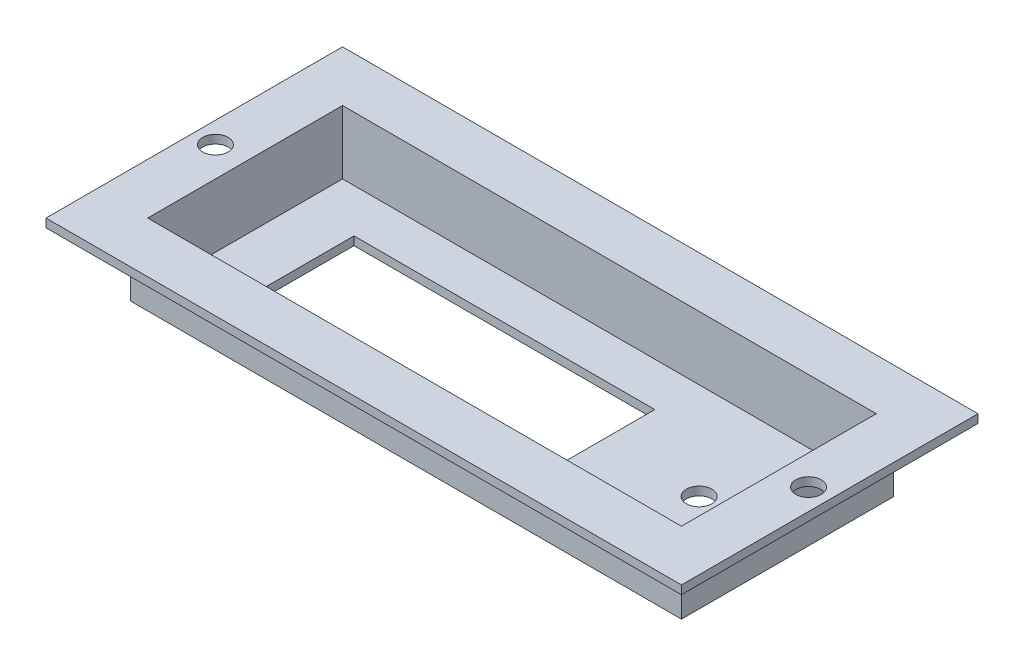
from build123d import *

# Parameters (mm, degrees)
CROQUIS1_W              = 130
CROQUIS1_H              = 50
SALIENTE_EXTRUIR1_DEPTH = 30
CROQUIS2_W              = 126
CROQUIS2_H              = 46
CORTAR_EXTRUIR1_DEPTH   = 28
CROQUIS3_R              = 3
CROQUIS3_W              = 70.999999967
CROQUIS3_H              = 24.5
CORTAR_EXTRUIR2_DEPTH   = 2
CROQUIS9_W              = 150
CROQUIS9_H              = 70
CROQUIS9_W_2            = 130
CROQUIS9_H_2            = 50
SALIENTE_EXTRUIR3_DEPTH = 15
CROQUIS9_2_W            = 150
CROQUIS9_2_H            = 70
CROQUIS9_2_W_2          = 130
CROQUIS9_2_H_2          = 50
CORTAR_EXTRUIR5_DEPTH   = 13
CROQUIS11_R             = 3
CORTAR_EXTRUIR6_DEPTH   = 2
CROQUIS12_W             = 50
CROQUIS12_H             = 13
CORTAR_EXTRUIR7_DEPTH   = 130


with BuildPart() as part:
    # Croquis1 → Saliente-Extruir1 (new body)
    with BuildSketch(Plane(origin=(0, 0, 0), x_dir=(1, 0, 0), z_dir=(0, 1, 0))):
        Rectangle(CROQUIS1_W, CROQUIS1_H)
    extrude(amount=SALIENTE_EXTRUIR1_DEPTH)

    # Croquis2 → Cortar-Extruir1 (cut)
    with BuildSketch(Plane(origin=(0, 30, 0), x_dir=(1, 0, 0), z_dir=(0, 1, 0))):
        Rectangle(CROQUIS2_W, CROQUIS2_H)
    extrude(amount=-CORTAR_EXTRUIR1_DEPTH, mode=Mode.SUBTRACT)

    # Croquis3 → Cortar-Extruir2 (cut)
    with BuildSketch(Plane.XZ):
        with Locations(Location((43.9980881, -0.173527089, 0), (0, 0, 270))):
            Circle(CROQUIS3_R)
        with Locations((-14.500000016, -0.45006101)):
            Rectangle(CROQUIS3_W, CROQUIS3_H)
    extrude(amount=-CORTAR_EXTRUIR2_DEPTH, mode=Mode.SUBTRACT)

    # Croquis9 → Saliente-Extruir3 (add)
    with BuildSketch(Plane(origin=(0, 30, 0), x_dir=(1, 0, 0), z_dir=(0, 1, 0))):
        Rectangle(CROQUIS9_W, CROQUIS9_H)
        Rectangle(CROQUIS9_W_2, CROQUIS9_H_2, mode=Mode.SUBTRACT)
    extrude(amount=-SALIENTE_EXTRUIR3_DEPTH)

    # Croquis9<2> → Cortar-Extruir5 (cut)
    with BuildSketch(Plane(origin=(0, 30, 0), x_dir=(1, 0, 0), z_dir=(0, 1, 0))):
        Rectangle(CROQUIS9_2_W, CROQUIS9_2_H)
        Rectangle(CROQUIS9_2_W_2, CROQUIS9_2_H_2, mode=Mode.SUBTRACT)
    extrude(amount=-CORTAR_EXTRUIR5_DEPTH, mode=Mode.SUBTRACT)

    # Croquis11 → Cortar-Extruir6 (cut)
    with BuildSketch(Plane(origin=(0, 17, 0), x_dir=(1, 0, 0), z_dir=(0, 1, 0))):
        with Locations(Location((-70, 0, 0), (0, 0, 270))):
            Circle(CROQUIS11_R)
        with Locations(Location((70, 0, 0), (0, 0, 270))):
            Circle(CROQUIS11_R)
    extrude(amount=-CORTAR_EXTRUIR6_DEPTH, mode=Mode.SUBTRACT)

    # Croquis12 → Cortar-Extruir7 (cut)
    with BuildSketch(Plane.ZY.offset(65)):
        with Locations((0, 23.5)):
            Rectangle(CROQUIS12_W, CROQUIS12_H)
    extrude(amount=-CORTAR_EXTRUIR7_DEPTH, mode=Mode.SUBTRACT)


solid = part.part
